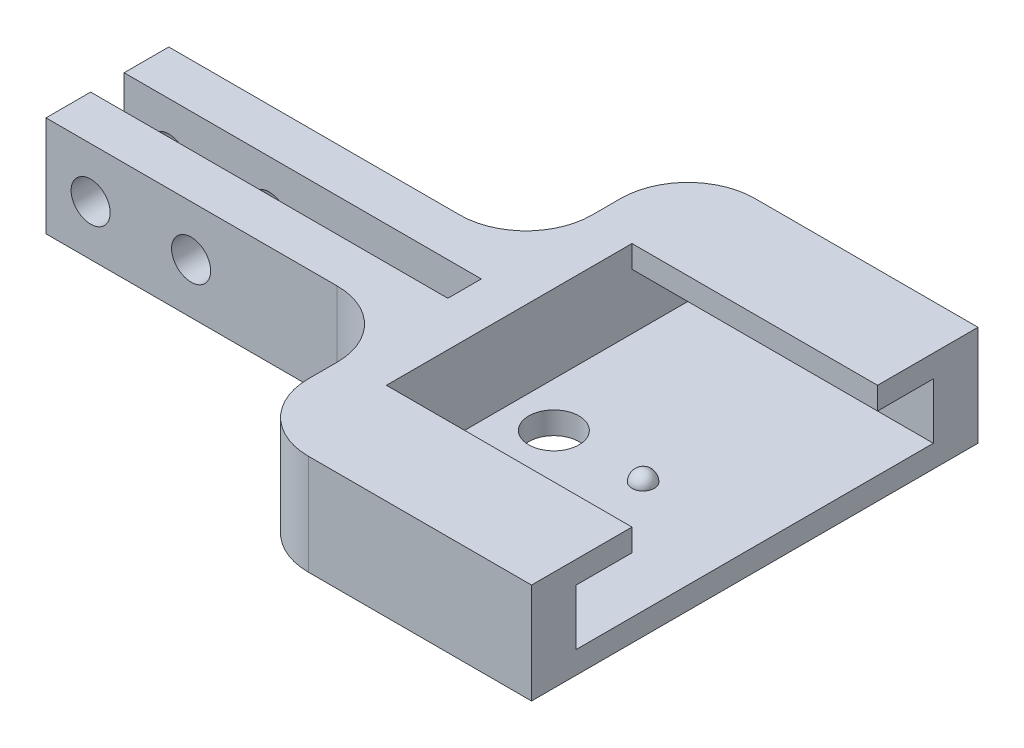
from build123d import *
from build123d.topology import SkipClean

# Parameters (mm, degrees)
SALIENTE_EXTRUIR1_DEPTH    = 4.5
CORTAR_EXTRUIR4_DEPTH      = 10
CORTAR_EXTRUIR4_DEPTH_BACK = 28.546551508
CROQUIS7_R                 = 0.875
CORTAR_EXTRUIR5_DEPTH      = 11
CROQUIS9_R                 = 1.125
CORTAR_EXTRUIR6_DEPTH      = 27.234519245


with BuildPart() as part:
    # Croquis1 → Saliente-Extruir1 (new body)
    with BuildSketch(Plane(origin=(0, 0, 0), x_dir=(1, 0, 0), z_dir=(0, 1, 0))):
        with BuildLine():
            Line((-5, -10), (5, -10))
            Line((5, -10), (5, 10))
            Line((5, 10), (-5, 10))
            ThreePointArc((-5, 10), (-7.121320344, 9.121320344), (-8, 7))
            Line((-8, 7), (-8, 5.703831235))
            ThreePointArc((-8, 5.703831235), (-8.865157138, 3.615157138), (-10.953831235, 2.75))
            Line((-10.953831235, 2.75), (-24, 2.75))
            Line((-24, 2.75), (-24, 0.75))
            Line((-24, 0.75), (-8, 0.75))
            Line((-8, 0.75), (-8, -0.75))
            Line((-8, -0.75), (-24, -0.75))
            Line((-24, -0.75), (-24, -2.75))
            Line((-24, -2.75), (-10.953831235, -2.75))
            ThreePointArc((-10.953831235, -2.75), (-8.865157138, -3.615157138), (-8, -5.703831235))
            Line((-8, -5.703831235), (-8, -7))
            ThreePointArc((-8, -7), (-7.121320344, -9.121320344), (-5, -10))
        make_face()
    extrude(amount=SALIENTE_EXTRUIR1_DEPTH)

    # Croquis7 → Cortar-Extruir4 (cut, two sides: drawn at the far end of the back side and taken through both)
    with BuildSketch(Plane.XY.offset(2.75).offset(-CORTAR_EXTRUIR4_DEPTH_BACK)):
        with Locations(Location((-22, 2.25, 0), (0, 0, 180))):
            Circle(CROQUIS7_R)
        with Locations(Location((-17.5, 2.25, 0), (0, 0, 180))):
            Circle(CROQUIS7_R)
    extrude(amount=CORTAR_EXTRUIR4_DEPTH + CORTAR_EXTRUIR4_DEPTH_BACK, mode=Mode.SUBTRACT)

    # Croquis8 → Cortar-Extruir5 (cut)
    with BuildSketch(Plane(origin=(5, 0, 0), x_dir=(0, 0, -1), z_dir=(1, 0, 0))):
        Polygon((-8, 1), (8, 1), (8, 3.5), (5.5, 3.5), (5.5, 4.5), (-5.5, 4.5), (-5.5, 3.5), (-8, 3.5), align=None)
    extrude(amount=-CORTAR_EXTRUIR5_DEPTH, mode=Mode.SUBTRACT)

    # Croquis9 → Cortar-Extruir6 (cut, through all)
    with BuildSketch(Plane(origin=(0, 1, 0), x_dir=(1, 0, 0), z_dir=(0, 1, 0))):
        with Locations(Location((-4, 0, 0), (0, 0, 270))):
            Circle(CROQUIS9_R)
    extrude(amount=-CORTAR_EXTRUIR6_DEPTH, mode=Mode.SUBTRACT)

    # Croquis11 → Revolución2 (revolve)
    with SkipClean():  # the faces are left unmerged after this step: merging them gives an invalid solid
        with BuildSketch(Plane(origin=(0, 0, 0), x_dir=(0, 0, -1), z_dir=(1, 0, 0))):
            with BuildLine():
                Line((-0.5, 1), (0.5, 1))
                ThreePointArc((0.5, 1), (0, 1.5), (-0.5, 1))
            make_face()
        revolve(axis=Axis((0, 1, 0.5), (0, 0, -1)))


solid = part.part
